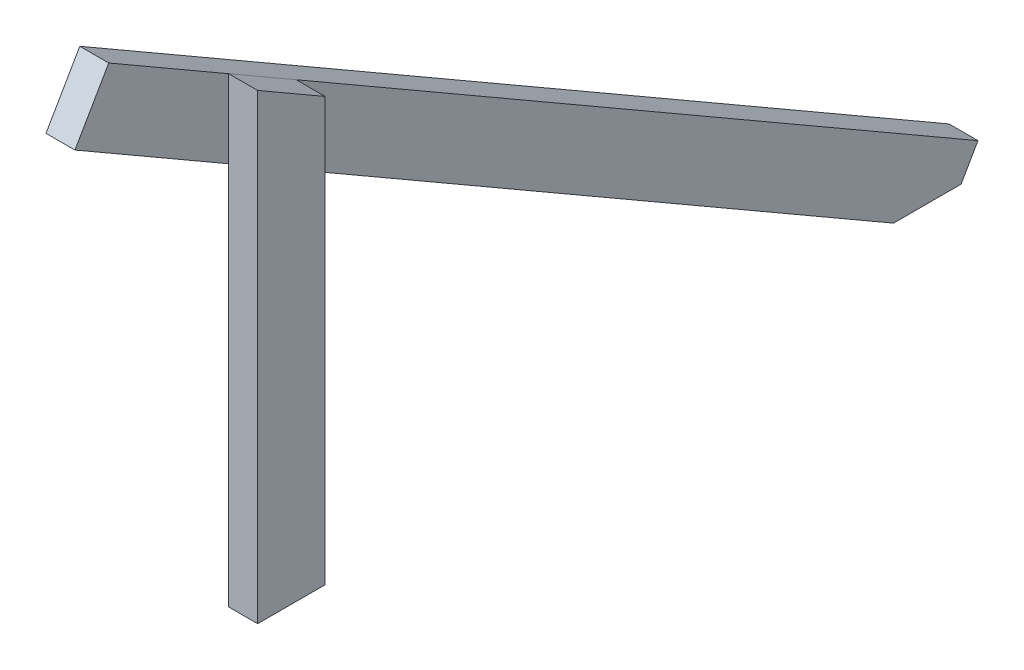
from build123d import *

# Parameters (mm, degrees)
SKETCH_2X4_W            = 38.1
SKETCH_2X4_H            = 88.9
PROFILES_2X4_1_DEPTH    = 1320.8
SKETCH_2X41_W           = 38.1
SKETCH_2X41_H           = 88.9
PROFILES_2X4_2_DEPTH    = 530.758809707
BODY_2_RUN_ON_DEPTH     = 595.55442
CUT_EXTRUDE1_DEPTH      = 1361.010291619
CUT_EXTRUDE1_DEPTH_BACK = 1361.010291619


with BuildPart() as part:
    # 2x4 → Profiles 2X4(1) (new body)
    with BuildSketch(Plane(origin=(0, 0, 0), x_dir=(1, 0, 0), z_dir=(0, 0.5000000000000009, 0.8660254037844382))):
        Rectangle(SKETCH_2X4_W, SKETCH_2X4_H)
    extrude(amount=PROFILES_2X4_1_DEPTH)

    # Sketch5 → Cut-Extrude1 (cut, two sides: drawn at the far end of the back side and taken through both)
    with BuildSketch(Plane(origin=(19.05, 0, 0), x_dir=(0, 0, -1), z_dir=(1, 0, 0)).offset(-CUT_EXTRUDE1_DEPTH_BACK)):
        Polygon((-3831.136128898, 0), (-764.986915909, 0), (192.809811734, 0), (3258.959024723, 0), (3258.959024723, -6132.298425979), (-3831.136128898, -6132.298425979), align=None)
    extrude(amount=CUT_EXTRUDE1_DEPTH + CUT_EXTRUDE1_DEPTH_BACK, mode=Mode.SUBTRACT)


with BuildPart() as body_2:
    # 2x41 → Profiles 2X4(2) (new body)
    with BuildSketch(Plane(origin=(38.1, 530.758809707, 919.301224977), x_dir=(1, 0, 0), z_dir=(0, -1, 0))):
        Rectangle(SKETCH_2X41_W, SKETCH_2X41_H)
    extrude(amount=PROFILES_2X4_2_DEPTH)

    # 2x41 → body 2 run on (add)
    with BuildSketch(Plane(origin=(38.1, 530.758809707, 919.301224977), x_dir=(1, 0, 0), z_dir=(0, -1, 0))):
        Rectangle(SKETCH_2X41_W, SKETCH_2X41_H)
    extrude(amount=-BODY_2_RUN_ON_DEPTH)

    # Trim_Extend1 6
    split(bisect_by=Plane(origin=(0, 368.694829198, 549.698176659), x_dir=(1, 0, 0), z_dir=(0, -0.866025404, 0.5)), keep=Keep.TOP)


solid = Compound([part.part, body_2.part])
